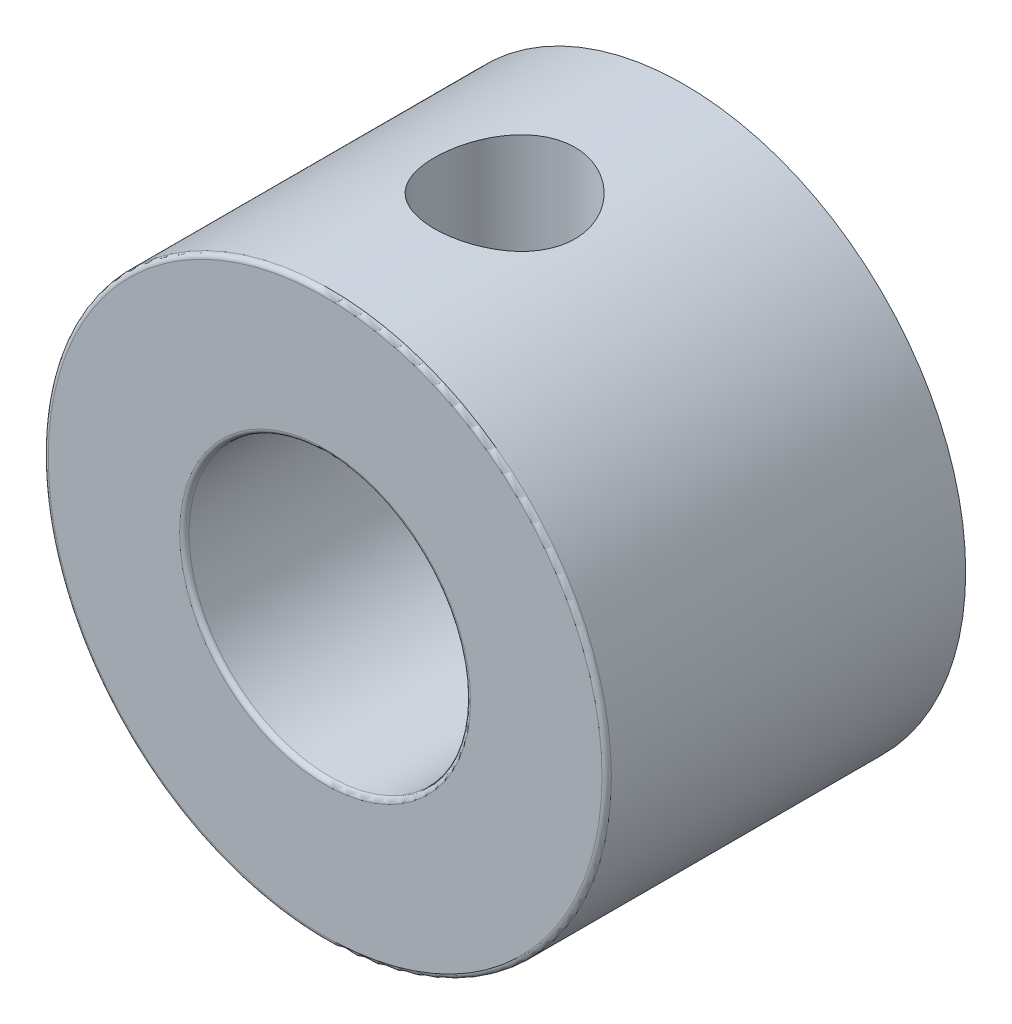
from build123d import *

# Parameters (mm, degrees)
SKETCH_1_R          = 6
SKETCH_1_R_2        = 3
EXTRUDE_1_DEPTH     = 3.825
FILLET_1_R          = 0.1
SKETCH_2_R          = 1.5
CUT_EXTRUDE_1_DEPTH = 7.65


with BuildPart() as part:
    # 草圖1 → 填料-伸長1 (new, symmetric)
    with BuildSketch(Plane.XY):
        Circle(SKETCH_1_R)
        Circle(SKETCH_1_R_2, mode=Mode.SUBTRACT)
    extrude(amount=EXTRUDE_1_DEPTH, both=True)

    # 圓角1
    fillet_1_edges = [part.edges().sort_by_distance(p)[0] for p in [
        (-6, 0, 3.825),
        (-3, 0, -3.825),
        (-3, 0, 3.825),
    ]]
    fillet(fillet_1_edges, radius=FILLET_1_R)

    # 草圖2 → 除料-伸長1 (cut)
    with BuildSketch(Plane(origin=(0, 0, 0), x_dir=(1, 0, 0), z_dir=(0, 1, 0))):
        with Locations(Location((0, 0, 0), (0, 0, 90))):
            Circle(SKETCH_2_R)
    extrude(amount=CUT_EXTRUDE_1_DEPTH, mode=Mode.SUBTRACT)


solid = part.part
